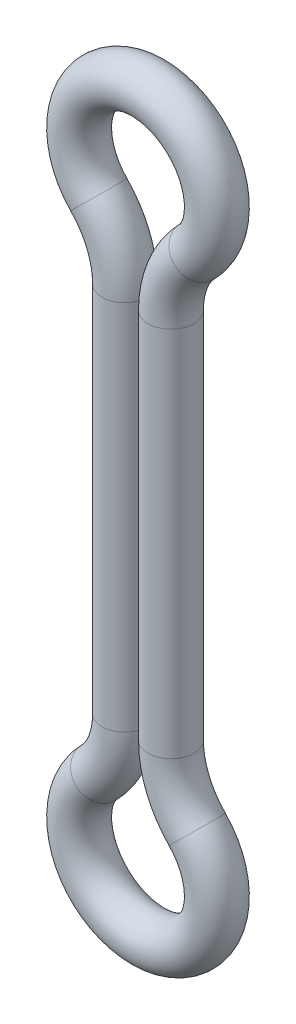
from build123d import *

# Parameters (mm, degrees)
SKETCH2_R = 2


with BuildPart() as part:
    # Sweep1: sweep along a path in Sketch1
    with BuildLine(Plane.XY) as sweep1_path:
        Line((4, 9.797958971), (4, 42.202041029))
        ThreePointArc((4, 42.202041029), (4.593439202, 45.225756813), (6.285714286, 47.800874727))
        ThreePointArc((6.285714286, 47.800874727), (2, 58), (-2.285714286, 47.800874727))
        ThreePointArc((-2.285714286, 47.800874727), (-0.593439202, 45.225756813), (0, 42.202041029))
        Line((0, 42.202041029), (0, 9.797958971))
        ThreePointArc((0, 9.797958971), (-0.593439202, 6.774243187), (-2.285714286, 4.199125273))
        ThreePointArc((-2.285714286, 4.199125273), (2, -6), (6.285714286, 4.199125273))
        ThreePointArc((6.285714286, 4.199125273), (4.593439202, 6.774243187), (4, 9.797958971))
    # Sketch2 → Sweep1 (sweep)
    with BuildSketch(Plane(origin=(0, 10, 0), x_dir=(-1, 0, 0), z_dir=(0, 1, 0))):
        Circle(SKETCH2_R)
    sweep(path=sweep1_path.line)


solid = part.part
